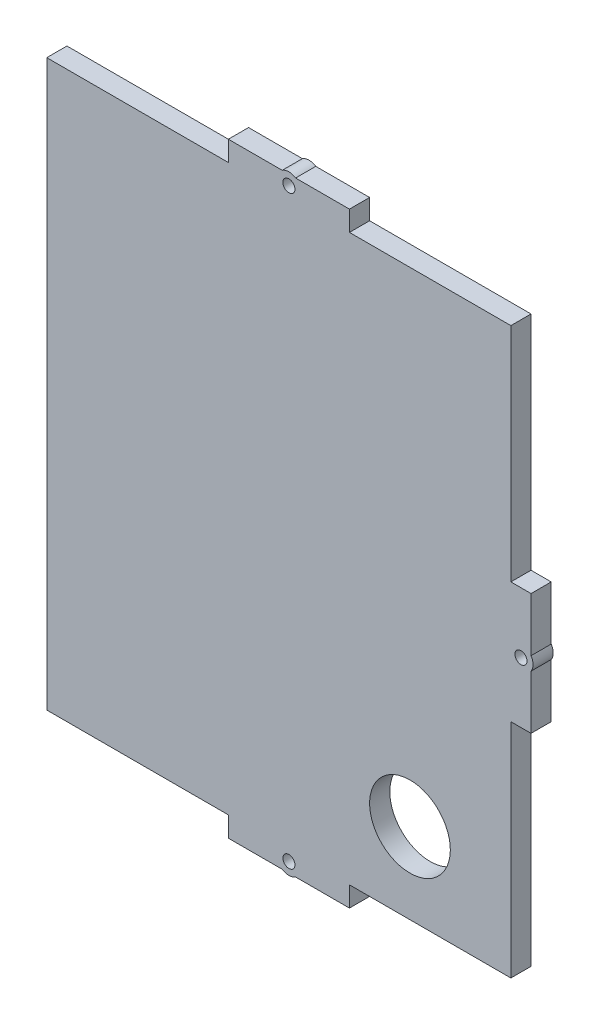
from build123d import *

# Parameters (mm, degrees)
ESQUISSE1_W             = 110
ESQUISSE1_H             = 140
ESQUISSE1_R             = 1.5
BOSS_EXTRU_1_DEPTH      = 5
ESQUISSE2_W             = 5
ESQUISSE2_H             = 140
BOSS_EXTRU_2_DEPTH      = 5
ESQUISSE3_R             = 10
ENL_V_MAT_EXTRU_1_DEPTH = 10


with BuildPart() as part:
    # Esquisse1 → Boss.-Extru.1 (new body)
    # profile 1 of 5: a face of its own
    with BuildSketch(Plane.XY):
        Rectangle(ESQUISSE1_W, ESQUISSE1_H)
    # profile 2 of 5: a face of its own
    with BuildSketch(Plane.XY):
        Polygon((-15, 70), (-55, 70), (-55, 15), (-55, -15), (-55, -70), (-15, -70), (15, -70), (55, -70), (55, -15), (55, 15), (55, 70), (15, 70), align=None)
    # profile 3 of 5: a face of its own
    with BuildSketch(Plane.XY):
        with BuildLine():
            Line((15, -70), (-15, -70))
            Line((-15, -70), (-15, -75))
            Line((-15, -75), (-1.658312395, -75))
            ThreePointArc((-1.658312395, -75), (0, -75.5), (1.658312395, -75))
            Line((1.658312395, -75), (15, -75))
            Line((15, -75), (15, -70))
        make_face()
        with Locations((0, -72.5)):
            Circle(ESQUISSE1_R, mode=Mode.SUBTRACT)
    # profile 4 of 5: a face of its own
    with BuildSketch(Plane.XY):
        with BuildLine():
            Line((60, 15), (55, 15))
            Line((55, 15), (55, -15))
            Line((55, -15), (60, -15))
            Line((60, -15), (60, -1.658312395))
            ThreePointArc((60, -1.658312395), (60.5, 0), (60, 1.658312395))
            Line((60, 1.658312395), (60, 15))
        make_face()
        with Locations((57.5, 0)):
            Circle(ESQUISSE1_R, mode=Mode.SUBTRACT)
    # profile 5 of 5: a face of its own
    with BuildSketch(Plane.XY):
        with BuildLine():
            Line((-15, 75), (-15, 70))
            Line((-15, 70), (15, 70))
            Line((15, 70), (15, 75))
            Line((15, 75), (1.658312395, 75))
            ThreePointArc((1.658312395, 75), (0, 75.5), (-1.658312395, 75))
            Line((-1.658312395, 75), (-15, 75))
        make_face()
        with Locations((0, 72.5)):
            Circle(ESQUISSE1_R, mode=Mode.SUBTRACT)
    extrude(amount=BOSS_EXTRU_1_DEPTH)

    # Esquisse2 → Boss.-Extru.2 (add)
    with BuildSketch(Plane.ZY.offset(55)):
        with Locations((2.5, 0)):
            Rectangle(ESQUISSE2_W, ESQUISSE2_H)
    extrude(amount=BOSS_EXTRU_2_DEPTH)

    # Esquisse3 → Enlèv. mat.-Extru.1 (cut)
    with BuildSketch(Plane.XY.offset(5)):
        with Locations((30, -50)):
            Circle(ESQUISSE3_R)
    extrude(amount=-ENL_V_MAT_EXTRU_1_DEPTH, mode=Mode.SUBTRACT)


solid = part.part
